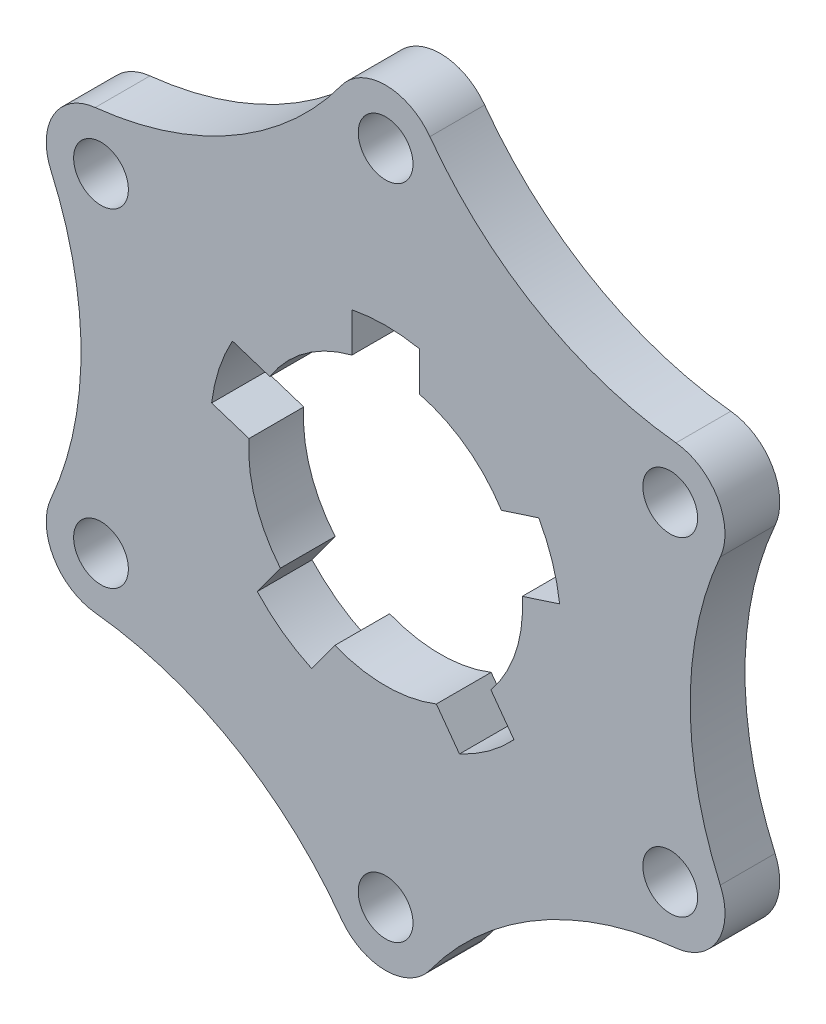
from build123d import *

# Parameters (mm, degrees)
CROQUIS1_R              = 5
SALIENTE_EXTRUIR1_DEPTH = 10


with BuildPart() as part:
    # Croquis1 → Saliente-Extruir1 (new body)
    with BuildSketch(Plane.XY):
        with BuildLine():
            ThreePointArc((8.081598806, 65.88963163), (0, 70), (-8.081598806, 65.88963163))
            ThreePointArc((-8.081598806, 65.88963163), (-27.803831164, 48.157648221), (-53.021295435, 39.943685684))
            ThreePointArc((-53.021295435, 39.943685684), (-60.621778265, 35), (-61.102894241, 25.945945946))
            ThreePointArc((-61.102894241, 25.945945946), (-55.607662328, 0), (-61.102894241, -25.945945946))
            ThreePointArc((-61.102894241, -25.945945946), (-60.621778265, -35), (-53.021295435, -39.943685684))
            ThreePointArc((-53.021295435, -39.943685684), (-27.803831164, -48.157648221), (-8.081598806, -65.88963163))
            ThreePointArc((-8.081598806, -65.88963163), (0, -70), (8.081598806, -65.88963163))
            ThreePointArc((8.081598806, -65.88963163), (27.803831164, -48.157648221), (53.021295435, -39.943685684))
            ThreePointArc((53.021295435, -39.943685684), (60.621778265, -35), (61.102894241, -25.945945946))
            ThreePointArc((61.102894241, -25.945945946), (55.607662328, 0), (61.102894241, 25.945945946))
            ThreePointArc((61.102894241, 25.945945946), (60.621778265, 35), (53.021295435, 39.943685684))
            ThreePointArc((53.021295435, 39.943685684), (27.803831164, 48.157648221), (8.081598806, 65.88963163))
        make_face()
        with Locations((0, 60)):
            Circle(CROQUIS1_R, mode=Mode.SUBTRACT)
        with Locations((51.961524227, 30)):
            Circle(CROQUIS1_R, mode=Mode.SUBTRACT)
        with Locations((51.961524227, -30)):
            Circle(CROQUIS1_R, mode=Mode.SUBTRACT)
        with Locations((0, -60)):
            Circle(CROQUIS1_R, mode=Mode.SUBTRACT)
        with Locations((-51.961524227, -30)):
            Circle(CROQUIS1_R, mode=Mode.SUBTRACT)
        with Locations((-51.961524227, 30)):
            Circle(CROQUIS1_R, mode=Mode.SUBTRACT)
        with BuildLine():
            Line((27.966013781, 15.553201382), (21.14530514, 13.337018802))
            ThreePointArc((21.14530514, 13.337018802), (14.694631307, 20.225424859), (6.15, 24.231745707))
            Line((6.15, 24.231745707), (6.15, 31.403463185))
            ThreePointArc((6.15, 31.403463185), (0, 32), (-6.15, 31.403463185))
            Line((-6.15, 31.403463185), (-6.15, 24.231745707))
            ThreePointArc((-6.15, 24.231745707), (-14.694631307, 20.225424859), (-21.14530514, 13.337018802))
            Line((-21.14530514, 13.337018802), (-27.966013781, 15.553201382))
            ThreePointArc((-27.966013781, 15.553201382), (-30.433808521, 9.88854382), (-31.766922812, 3.855206231))
            Line((-31.766922812, 3.855206231), (-24.946214171, 1.639023652))
            ThreePointArc((-24.946214171, 1.639023652), (-23.776412907, -7.725424859), (-19.218517279, -15.989014779))
            Line((-19.218517279, -15.989014779), (-23.433947046, -21.791056097))
            ThreePointArc((-23.433947046, -21.791056097), (-18.809128073, -25.88854382), (-13.483038016, -29.0208147))
            Line((-13.483038016, -29.0208147), (-9.267608248, -23.218773382))
            ThreePointArc((-9.267608248, -23.218773382), (0, -25), (9.267608248, -23.218773382))
            Line((9.267608248, -23.218773382), (13.483038016, -29.0208147))
            ThreePointArc((13.483038016, -29.0208147), (18.809128073, -25.88854382), (23.433947046, -21.791056097))
            Line((23.433947046, -21.791056097), (19.218517279, -15.989014779))
            ThreePointArc((19.218517279, -15.989014779), (23.776412907, -7.725424859), (24.946214171, 1.639023652))
            Line((24.946214171, 1.639023652), (31.766922812, 3.855206231))
            ThreePointArc((31.766922812, 3.855206231), (30.433808521, 9.88854382), (27.966013781, 15.553201382))
        make_face(mode=Mode.SUBTRACT)
    extrude(amount=SALIENTE_EXTRUIR1_DEPTH)


solid = part.part
